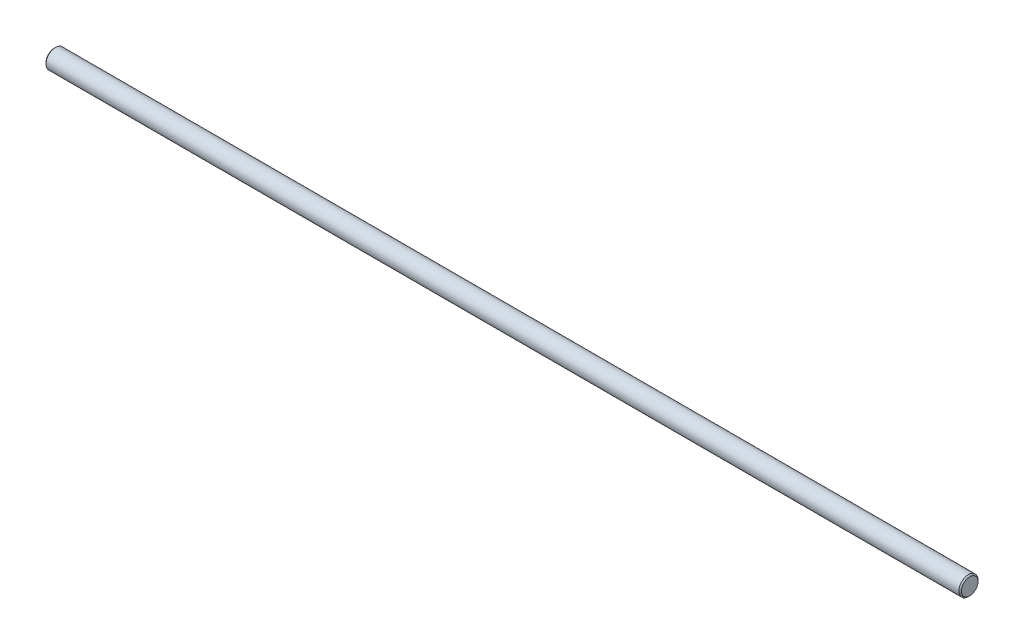
from build123d import *

# Parameters (mm, degrees)
SKETCH1_R           = 9.525
BOSS_EXTRUDE1_DEPTH = 457.2
CHAMFER1_SIZE       = 1.27


with BuildPart() as part:
    # Sketch1 → Boss-Extrude1 (new, symmetric)
    with BuildSketch(Plane(origin=(0, 0, 0), x_dir=(0, 0, -1), z_dir=(1, 0, 0))):
        Circle(SKETCH1_R)
    extrude(amount=BOSS_EXTRUDE1_DEPTH, both=True)

    # Chamfer1
    chamfer1_edges = [part.edges().sort_by_distance(p)[0] for p in [
        (-457.2, 0, 9.525),
        (457.2, 0, 9.525),
    ]]
    chamfer(chamfer1_edges, length=CHAMFER1_SIZE)


solid = part.part
